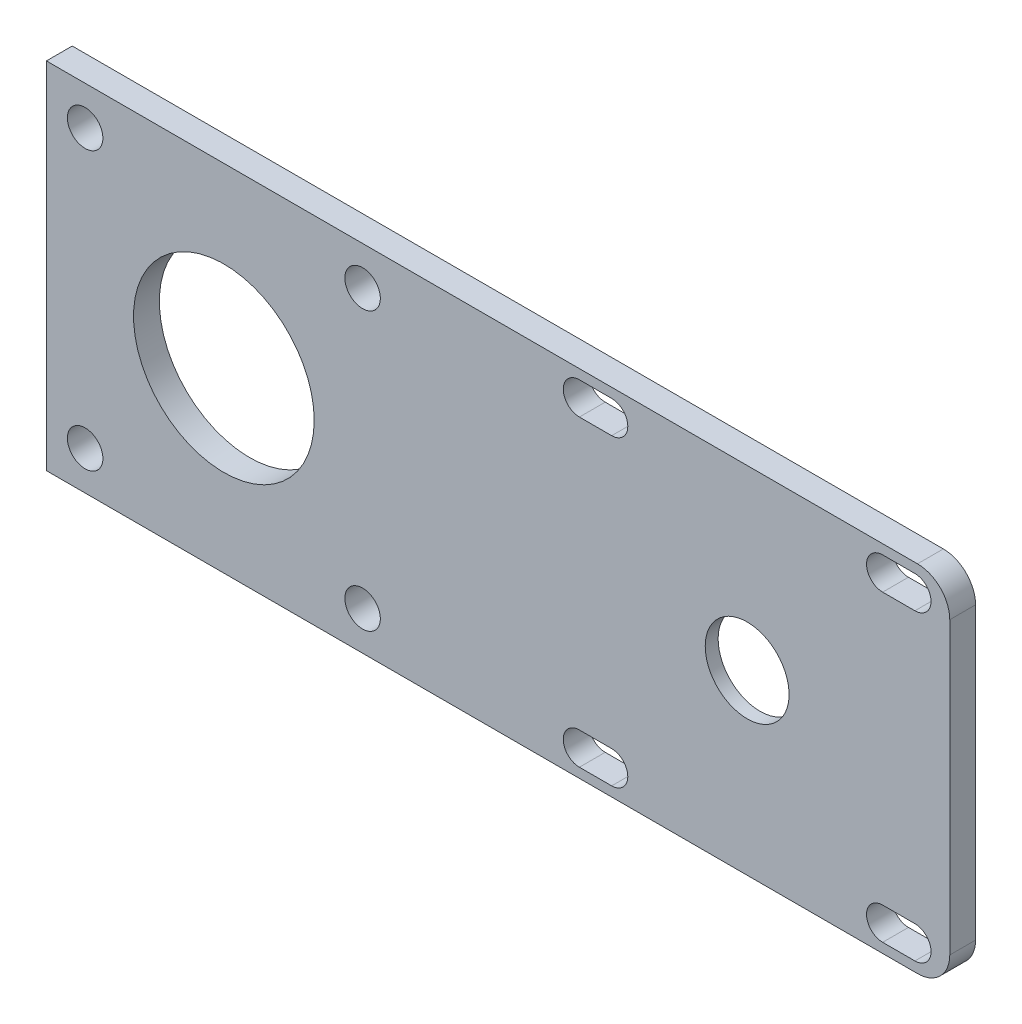
from build123d import *

# Parameters (mm, degrees)
SCHIZZO1_W                   = 140
SCHIZZO1_H                   = 55
ESTRUSIONE_ESTRUSIONE1_DEPTH = 4
SCHIZZO2_R                   = 14
SCHIZZO2_R_2                 = 2.75
TAGLIO_ESTRUSIONE1_DEPTH     = 151.469265965
RACCORDO1_R                  = 5
SCHIZZO3_R                   = 6.5
TAGLIO_ESTRUSIONE2_DEPTH     = 151.469265965
TAGLIO_ESTRUSIONE3_DEPTH     = 2


with BuildPart() as part:
    # Schizzo1 → Estrusione-Estrusione1 (new body)
    with BuildSketch(Plane.XY):
        with Locations((70, 27.5)):
            Rectangle(SCHIZZO1_W, SCHIZZO1_H)
    extrude(amount=-ESTRUSIONE_ESTRUSIONE1_DEPTH)

    # Schizzo2 → Taglio-Estrusione1 (cut, through all)
    with BuildSketch(Plane.XY):
        with Locations((27.5, 27.5)):
            Circle(SCHIZZO2_R)
        with Locations((6, 6)):
            Circle(SCHIZZO2_R_2)
        with Locations(Location((49, 6, 0), (0, 0, 180))):
            Circle(SCHIZZO2_R_2)
        with Locations((49, 49)):
            Circle(SCHIZZO2_R_2)
        with Locations(Location((6, 49, 0), (0, 0, 180))):
            Circle(SCHIZZO2_R_2)
    extrude(amount=-TAGLIO_ESTRUSIONE1_DEPTH, mode=Mode.SUBTRACT)

    # Raccordo1
    raccordo1_edges = [part.edges().sort_by_distance(p)[0] for p in [
        (140, 55, -2),
        (140, 0, -2),
    ]]
    fillet(raccordo1_edges, radius=RACCORDO1_R)

    # Schizzo3 → Taglio-Estrusione2 (cut, through all)
    with BuildSketch(Plane(origin=(0, 0, -4), x_dir=(-1, 0, 0), z_dir=(0, 0, -1))):
        with Locations((-108.6, 27.5)):
            Circle(SCHIZZO3_R)
        with BuildLine():
            Line((-134.6, 53.5), (-129.6, 53.5))
            ThreePointArc((-129.6, 53.5), (-127.1, 51), (-129.6, 48.5))
            Line((-129.6, 48.5), (-134.6, 48.5))
            ThreePointArc((-134.6, 48.5), (-137.1, 51), (-134.6, 53.5))
        make_face()
        with BuildLine():
            Line((-82.6, 53.5), (-87.6, 53.5))
            ThreePointArc((-87.6, 53.5), (-90.1, 51), (-87.6, 48.5))
            Line((-87.6, 48.5), (-82.6, 48.5))
            ThreePointArc((-82.6, 48.5), (-80.1, 51), (-82.6, 53.5))
        make_face()
        with BuildLine():
            Line((-134.6, 1.5), (-129.6, 1.5))
            ThreePointArc((-129.6, 1.5), (-127.1, 4), (-129.6, 6.5))
            Line((-129.6, 6.5), (-134.6, 6.5))
            ThreePointArc((-134.6, 6.5), (-137.1, 4), (-134.6, 1.5))
        make_face()
        with BuildLine():
            Line((-82.6, 1.5), (-87.6, 1.5))
            ThreePointArc((-87.6, 1.5), (-90.1, 4), (-87.6, 6.5))
            Line((-87.6, 6.5), (-82.6, 6.5))
            ThreePointArc((-82.6, 6.5), (-80.1, 4), (-82.6, 1.5))
        make_face()
    extrude(amount=-TAGLIO_ESTRUSIONE2_DEPTH, mode=Mode.SUBTRACT)

    # Schizzo4 → Taglio-Estrusione3 (cut)
    with BuildSketch(Plane(origin=(0, 0, -4), x_dir=(-1, 0, 0), z_dir=(0, 0, -1))):
        with BuildLine():
            Line((-88.6, 9), (-128.6, 9))
            ThreePointArc((-128.6, 9), (-132.135533906, 10.464466094), (-133.6, 14))
            Line((-133.6, 14), (-133.6, 41))
            ThreePointArc((-133.6, 41), (-132.135533906, 44.535533906), (-128.6, 46))
            Line((-128.6, 46), (-88.6, 46))
            ThreePointArc((-88.6, 46), (-85.064466094, 44.535533906), (-83.6, 41))
            Line((-83.6, 41), (-83.6, 14))
            ThreePointArc((-83.6, 14), (-85.064466094, 10.464466094), (-88.6, 9))
        make_face()
    extrude(amount=-TAGLIO_ESTRUSIONE3_DEPTH, mode=Mode.SUBTRACT)


solid = part.part
